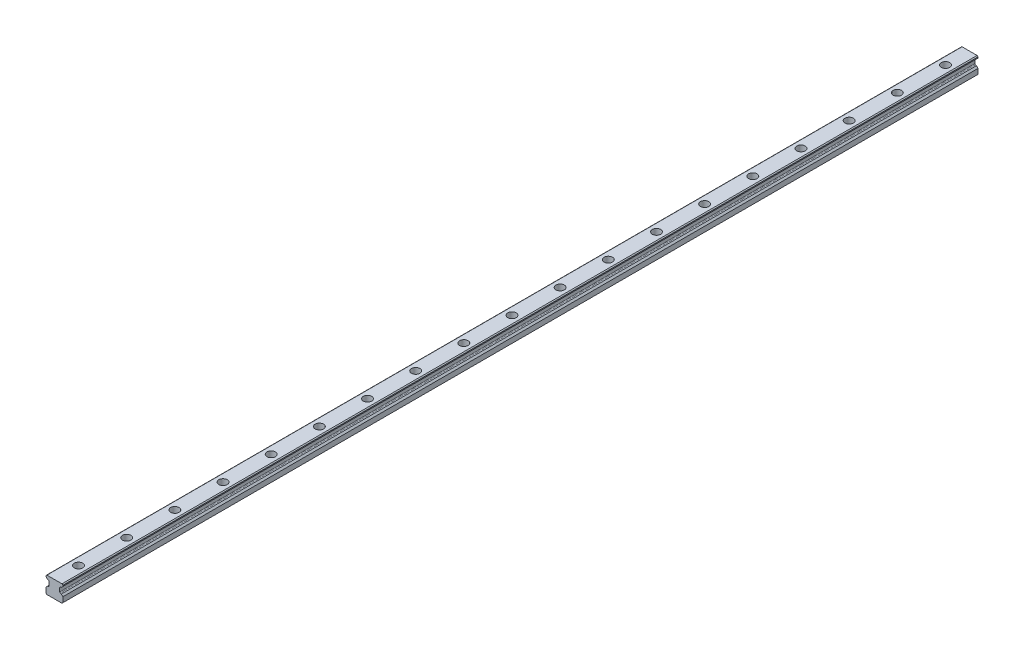
from build123d import *

# Parameters (mm, degrees)
BOSS_EXTRUDE1_DEPTH = 760
LPATTERN1_COUNT     = 2
LPATTERN1_PITCH     = 80
LPATTERN2_COUNT     = 9
LPATTERN2_PITCH     = 160


with BuildPart() as part:
    # Sketch1 → Boss-Extrude1 (new, symmetric)
    with BuildSketch(Plane.XY):
        with BuildLine():
            Line((-9.911771432, 13.106808119), (-11.43, 12.7))
            Line((-11.43, 12.7), (-14, 10.13))
            Line((-14, 10.13), (-14, 1.5))
            Line((-14, 1.5), (-12.5, 0))
            Line((-12.5, 0), (12.5, 0))
            Line((12.5, 0), (14, 1.5))
            Line((14, 1.5), (14, 10.13))
            Line((14, 10.13), (11.43, 12.7))
            Line((11.43, 12.7), (9.911771432, 13.106808119))
            ThreePointArc((9.911771432, 13.106808119), (9.10996999, 13.642554715), (8.8, 14.555696858))
            Line((8.8, 14.555696858), (8.8, 20.444303142))
            ThreePointArc((8.8, 20.444303142), (9.10996999, 21.357445285), (9.911771432, 21.893191881))
            Line((9.911771432, 21.893191881), (11.43, 22.3))
            Line((11.43, 22.3), (14, 24.87))
            Line((14, 24.87), (14, 26.5))
            ThreePointArc((14, 26.5), (13.416985894, 27.416985894), (12.5, 28))
            Line((12.5, 28), (-12.5, 28))
            ThreePointArc((-12.5, 28), (-13.416985894, 27.416985894), (-14, 26.5))
            Line((-14, 26.5), (-14, 24.87))
            Line((-14, 24.87), (-11.43, 22.3))
            Line((-11.43, 22.3), (-9.911771432, 21.893191881))
            ThreePointArc((-9.911771432, 21.893191881), (-9.10996999, 21.357445285), (-8.8, 20.444303142))
            Line((-8.8, 20.444303142), (-8.8, 14.555696858))
            ThreePointArc((-8.8, 14.555696858), (-9.10996999, 13.642554715), (-9.911771432, 13.106808119))
        make_face()
    extrude(amount=BOSS_EXTRUDE1_DEPTH, both=True)

    # Sketch2 → Cut-Revolve1 (revolve, cut)
    with BuildSketch(Plane(origin=(0, 0, 0), x_dir=(0, 0, -1), z_dir=(1, 0, 0)), mode=Mode.PRIVATE) as cut_revolve1_sk:
        Polygon((-720, 28), (-713, 28), (-713, 16), (-715.5, 16), (-715.5, 0), (-720, 0), align=None)
    cut_revolve1 = revolve(cut_revolve1_sk.sketch.rotate(Axis((0, 28, 720), (0, -1, 0)), 180), axis=Axis((0, 28, 720), (0, -1, 0)), mode=Mode.SUBTRACT)

    # LPattern1: Cut-Revolve1 ×2
    with Locations(*[(0, 0, -i * LPATTERN1_PITCH) for i in range(1, LPATTERN1_COUNT)]):
        add(cut_revolve1, mode=Mode.SUBTRACT)

    # Mirror1: Cut-Revolve1 across plane
    add(cut_revolve1.mirror(Plane.XY), mode=Mode.SUBTRACT)

    # Mirror1 copy 1 sketch → Mirror1 copy 1 (revolve, cut)
    with BuildSketch(Plane(origin=(0, 0, 80), x_dir=(0, 0, 1), z_dir=(1, 0, 0))):
        Polygon((-720, -28), (-713, -28), (-713, -16), (-715.5, -16), (-715.5, 0), (-720, 0), align=None)
    revolve(axis=Axis((0, 28, -640), (0, 1, 0)), mode=Mode.SUBTRACT)

    # LPattern2: Cut-Revolve1 ×9
    with Locations(*[(0, 0, -i * LPATTERN2_PITCH) for i in range(1, LPATTERN2_COUNT)]):
        add(cut_revolve1, mode=Mode.SUBTRACT)

    # LPattern2 copy 1 sketch → LPattern2 copy 1 (revolve, cut)
    with BuildSketch(Plane(origin=(0, 0, -240), x_dir=(0, 0, -1), z_dir=(1, 0, 0))):
        Polygon((-720, 28), (-713, 28), (-713, 16), (-715.5, 16), (-715.5, 0), (-720, 0), align=None)
    revolve(axis=Axis((0, 28, 480), (0, -1, 0)), mode=Mode.SUBTRACT)

    # LPattern2 copy 2 sketch → LPattern2 copy 2 (revolve, cut)
    with BuildSketch(Plane(origin=(0, 0, -400), x_dir=(0, 0, -1), z_dir=(1, 0, 0))):
        Polygon((-720, 28), (-713, 28), (-713, 16), (-715.5, 16), (-715.5, 0), (-720, 0), align=None)
    revolve(axis=Axis((0, 28, 320), (0, -1, 0)), mode=Mode.SUBTRACT)

    # LPattern2 copy 3 sketch → LPattern2 copy 3 (revolve, cut)
    with BuildSketch(Plane(origin=(0, 0, -560), x_dir=(0, 0, -1), z_dir=(1, 0, 0))):
        Polygon((-720, 28), (-713, 28), (-713, 16), (-715.5, 16), (-715.5, 0), (-720, 0), align=None)
    revolve(axis=Axis((0, 28, 160), (0, -1, 0)), mode=Mode.SUBTRACT)

    # LPattern2 copy 4 sketch → LPattern2 copy 4 (revolve, cut)
    with BuildSketch(Plane(origin=(0, 0, -720), x_dir=(0, 0, -1), z_dir=(1, 0, 0))):
        Polygon((-720, 28), (-713, 28), (-713, 16), (-715.5, 16), (-715.5, 0), (-720, 0), align=None)
    revolve(axis=Axis((0, 28, 0), (0, -1, 0)), mode=Mode.SUBTRACT)

    # LPattern2 copy 5 sketch → LPattern2 copy 5 (revolve, cut)
    with BuildSketch(Plane(origin=(0, 0, -880), x_dir=(0, 0, -1), z_dir=(1, 0, 0))):
        Polygon((-720, 28), (-713, 28), (-713, 16), (-715.5, 16), (-715.5, 0), (-720, 0), align=None)
    revolve(axis=Axis((0, 28, -160), (0, -1, 0)), mode=Mode.SUBTRACT)

    # LPattern2 copy 6 sketch → LPattern2 copy 6 (revolve, cut)
    with BuildSketch(Plane(origin=(0, 0, -1040), x_dir=(0, 0, -1), z_dir=(1, 0, 0))):
        Polygon((-720, 28), (-713, 28), (-713, 16), (-715.5, 16), (-715.5, 0), (-720, 0), align=None)
    revolve(axis=Axis((0, 28, -320), (0, -1, 0)), mode=Mode.SUBTRACT)

    # LPattern2 copy 7 sketch → LPattern2 copy 7 (revolve, cut)
    with BuildSketch(Plane(origin=(0, 0, -1200), x_dir=(0, 0, -1), z_dir=(1, 0, 0))):
        Polygon((-720, 28), (-713, 28), (-713, 16), (-715.5, 16), (-715.5, 0), (-720, 0), align=None)
    revolve(axis=Axis((0, 28, -480), (0, -1, 0)), mode=Mode.SUBTRACT)

    # LPattern2 copy 8 sketch → LPattern2 copy 8 (revolve, cut)
    with BuildSketch(Plane(origin=(0, 0, -1360), x_dir=(0, 0, -1), z_dir=(1, 0, 0))):
        Polygon((-720, 28), (-713, 28), (-713, 16), (-715.5, 16), (-715.5, 0), (-720, 0), align=None)
    revolve(axis=Axis((0, 28, -640), (0, -1, 0)), mode=Mode.SUBTRACT)


solid = part.part
